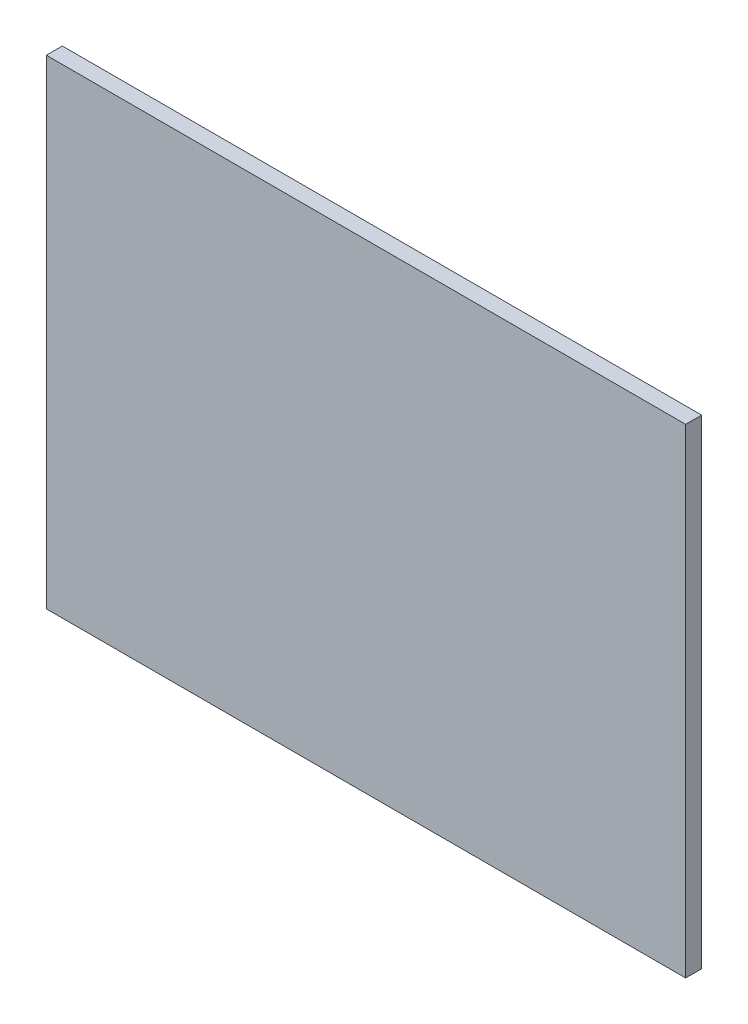
from build123d import *

# Parameters (mm, degrees)
IZIM1_W                     = 200
IZIM1_H                     = 150
Y_KSEKLIK_EKSTR_ZYON1_DEPTH = 5


with BuildPart() as part:
    # Çizim1 → Yükseklik-Ekstrüzyon1 (new body)
    with BuildSketch(Plane.XY):
        Rectangle(IZIM1_W, IZIM1_H)
    extrude(amount=Y_KSEKLIK_EKSTR_ZYON1_DEPTH)


solid = part.part
